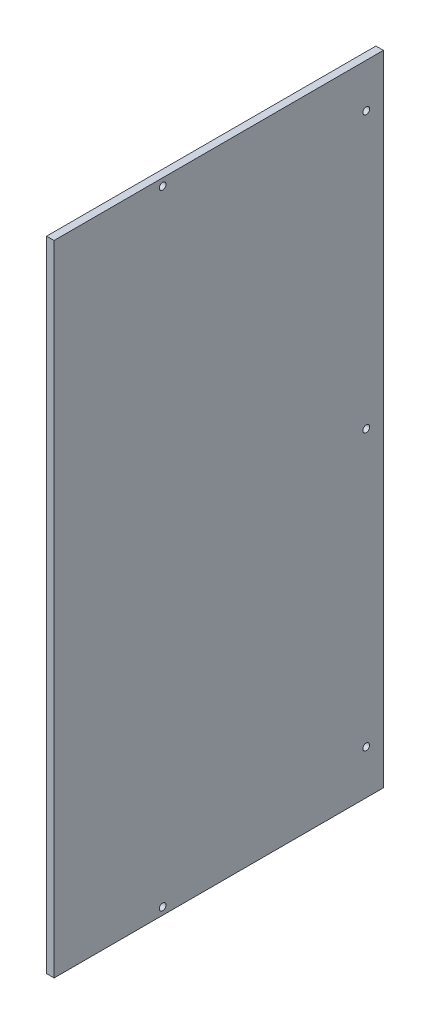
from build123d import *

# Parameters (mm, degrees)
SKETCH1_W             = 209.55
SKETCH1_H             = 406.4
BOSS_EXTRUDE1_DEPTH   = 4.7625
F_8_CLEARANCE_HOLE1_D = 4.3053


with BuildPart() as part:
    # Sketch1 → Boss-Extrude1 (new body)
    with BuildSketch(Plane(origin=(0, 0, 0), x_dir=(0, 0, -1), z_dir=(1, 0, 0))):
        with Locations((38.266318423, 86.502811245)):
            Rectangle(SKETCH1_W, SKETCH1_H)
    extrude(amount=BOSS_EXTRUDE1_DEPTH)

    # #8 Clearance Hole1 (through all)
    with Locations(Plane.ZY):
        with Locations((-132.119318423, -88.630188755), (-132.119318423, 261.889811245), (-132.119318423, 86.629811245), (-2.579318423, -112.061688755), (-2.579318423, 285.067311245)):
            Hole(F_8_CLEARANCE_HOLE1_D / 2)


solid = part.part
